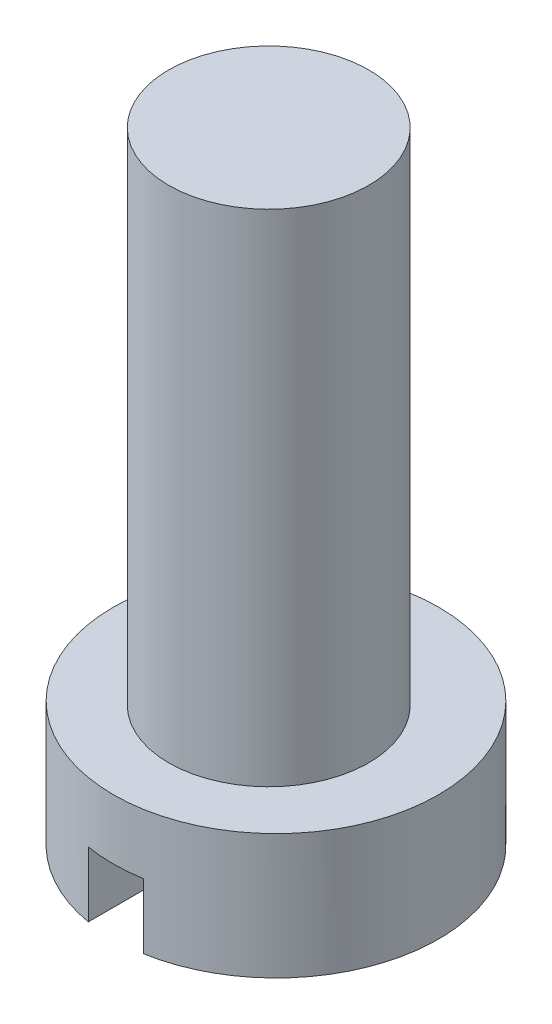
from build123d import *

# Parameters (mm, degrees)
SKETCH_1_R          = 6.5
EXTRUDE_1_DEPTH     = 5
SKETCH_2_W          = 2.2
SKETCH_2_H          = 2.6
CUT_EXTRUDE_1_DEPTH = 6.95
SKETCH_3_R          = 4
EXTRUDE_2_DEPTH     = 20


with BuildPart() as part:
    # Эскиз1 → Бобышка-Вытянуть1 (new body)
    with BuildSketch(Plane(origin=(0, 0, 0), x_dir=(1, 0, 0), z_dir=(0, 1, 0))):
        with Locations(Location((0, 0, 0), (0, 0, 270))):
            Circle(SKETCH_1_R)
    extrude(amount=EXTRUDE_1_DEPTH)

    # Эскиз2 → Вырез-Вытянуть1 (cut, symmetric)
    with BuildSketch(Plane.XY):
        with Locations((0, 1.3)):
            Rectangle(SKETCH_2_W, SKETCH_2_H)
    extrude(amount=CUT_EXTRUDE_1_DEPTH, both=True, mode=Mode.SUBTRACT)

    # Эскиз3 → Бобышка-Вытянуть2 (add)
    with BuildSketch(Plane(origin=(0, 5, 0), x_dir=(1, 0, 0), z_dir=(0, 1, 0))):
        with Locations(Location((0, -0.29107227, 0), (0, 0, 270))):
            Circle(SKETCH_3_R)
    extrude(amount=EXTRUDE_2_DEPTH)


solid = part.part
